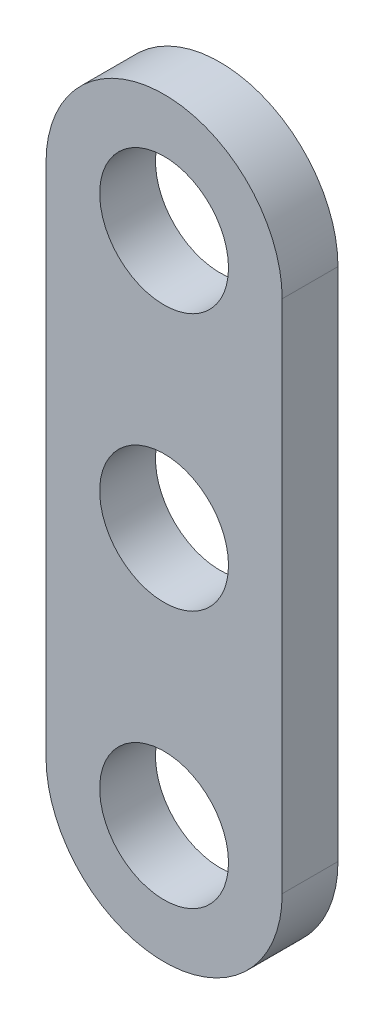
from build123d import *

# Parameters (mm, degrees)
SKETCH_1_R      = 3
EXTRUDE_1_DEPTH = 2.6


with BuildPart() as part:
    # 草图1 → 凸台-拉伸1 (new body)
    with BuildSketch(Plane.XY):
        with BuildLine():
            Line((5.5, 12), (5.5, -12))
            ThreePointArc((5.5, -12), (0, -17.5), (-5.5, -12))
            Line((-5.5, -12), (-5.5, 12))
            ThreePointArc((-5.5, 12), (0, 17.5), (5.5, 12))
        make_face()
        with Locations((0, -12)):
            Circle(SKETCH_1_R, mode=Mode.SUBTRACT)
        Circle(SKETCH_1_R, mode=Mode.SUBTRACT)
        with Locations((0, 12)):
            Circle(SKETCH_1_R, mode=Mode.SUBTRACT)
    extrude(amount=EXTRUDE_1_DEPTH)


solid = part.part
